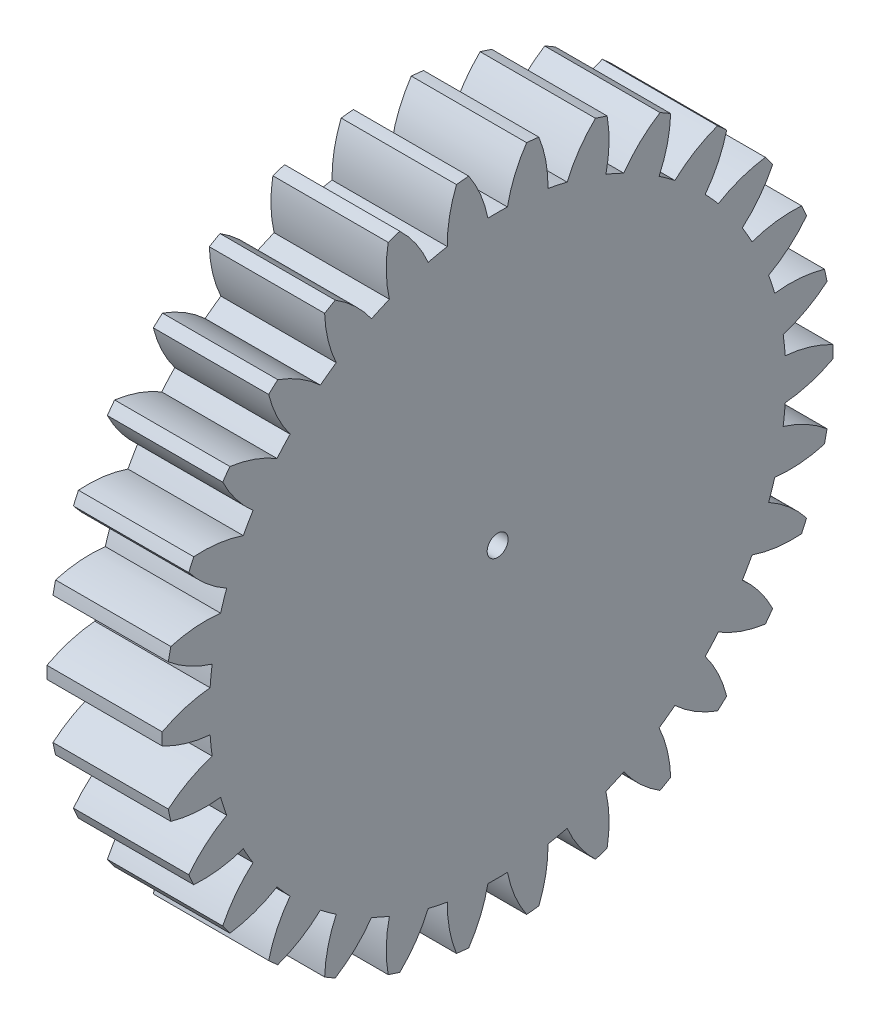
from build123d import *

# Parameters (mm, degrees)
BASPROSKE_W     = 5.5
BASPROSKE_H     = 16
TOOTHCUT_DEPTH  = 24.286262044
TEETHCUTS_COUNT = 30
TEETHCUTS_ANGLE = 348
BORSKE_R        = 0.5
BORE_DEPTH      = 50.0000508


with BuildPart() as part:
    # BasProSke → Base-Revolve (revolve)
    with BuildSketch(Plane(origin=(0, 0, 0), x_dir=(1, 0, 0), z_dir=(0, 1, 0)), mode=Mode.PRIVATE) as base_revolve_sk:
        with Locations((2.75, 8)):
            Rectangle(BASPROSKE_W, BASPROSKE_H)
    revolve(base_revolve_sk.sketch.rotate(Axis((-10, 0, 0), (1, 0, 0)), 180), axis=Axis((-10, 0, 0), (1, 0, 0)))

    # TooCutSke → ToothCut (cut, through all)
    with BuildSketch(Plane(origin=(0, 0, 0), x_dir=(0, 0, -1), z_dir=(1, 0, 0))):
        with BuildLine():
            ThreePointArc((0.466400716, 13.741086979), (0, 13.749), (-0.466400716, 13.741086979))
            ThreePointArc((-0.466400716, 13.741086979), (-0.819142092, 14.899954875), (-1.3974676, 15.964351834))
            ThreePointArc((-1.3974676, 15.964351834), (0, 16.0254), (1.3974676, 15.964351834))
            ThreePointArc((1.3974676, 15.964351834), (0.819142092, 14.899954875), (0.466400716, 13.741086979))
        make_face()
    toothcut = extrude(amount=TOOTHCUT_DEPTH, mode=Mode.SUBTRACT)

    # TeethCuts: ToothCut ×30 about axis
    teethcuts_axis = Axis((-10, 0, 0), (1, 0, 0))
    for i in range(1, TEETHCUTS_COUNT):
        add(toothcut.rotate(teethcuts_axis, i * TEETHCUTS_ANGLE / (TEETHCUTS_COUNT - 1)), mode=Mode.SUBTRACT)

    # BorSke → Bore (cut, symmetric)
    with BuildSketch(Plane(origin=(0, 0, 0), x_dir=(0, 0, -1), z_dir=(1, 0, 0))):
        with Locations(Location((0, 0, 0), (0, 0, 180))):
            Circle(BORSKE_R)
    extrude(amount=BORE_DEPTH, both=True, mode=Mode.SUBTRACT)


solid = part.part
